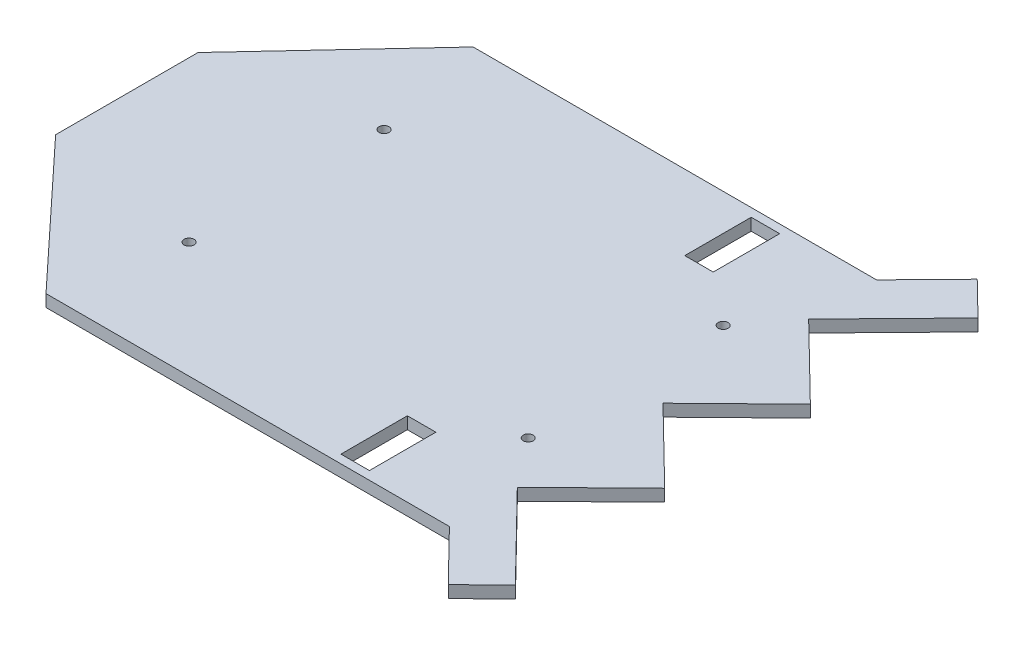
from build123d import *

# Parameters (mm, degrees)
BOSS_EXTRUDE2_DEPTH      = 5
BOSS_EXTRUDE2_DEPTH_BACK = 0.1
SKETCH6_R                = 2.1
CUT_EXTRUDE2_DEPTH       = 10
SKETCH2_W                = 12
SKETCH2_H                = 28
CUT_EXTRUDE3_DEPTH       = 10


with BuildPart() as part:
    # Sketch1 → Boss-Extrude2 (new, two sides: drawn at the far end of the back side and taken through both)
    with BuildSketch(Plane(origin=(0, 0, 0), x_dir=(1, 0, 0), z_dir=(0, 1, 0)).offset(-BOSS_EXTRUDE2_DEPTH_BACK)):
        Polygon((0, -30), (0, 30), (55.94480687, 90), (225.94480687, 90), (246.912660032, 111.45574827), (261.216492211, 97.477179495), (225.94480687, 61.384767177), (257.353801996, 30.69), (225.94480687, 0), (257.353801996, -30.69), (225.94480687, -61.384767177), (261.216492211, -97.477179495), (246.912660032, -111.45574827), (225.94480687, -90), (55.94480687, -90), align=None)
    extrude(amount=BOSS_EXTRUDE2_DEPTH + BOSS_EXTRUDE2_DEPTH_BACK)

    # Sketch6 → Cut-Extrude2 (cut)
    with BuildSketch(Plane(origin=(0, -0.1, 0), x_dir=(-1, 0, 0), z_dir=(0, -1, 0))):
        with Locations(Location((-67.309752753, 41.081967218, 0), (0, 0, 90))):
            Circle(SKETCH6_R)
        with Locations(Location((-210.227358504, 41.081967218, 0), (0, 0, 90))):
            Circle(SKETCH6_R)
        with Locations(Location((-210.227358504, -41.081967218, 0), (0, 0, 270))):
            Circle(SKETCH6_R)
        with Locations(Location((-67.309752753, -41.081967218, 0), (0, 0, 270))):
            Circle(SKETCH6_R)
    extrude(amount=-CUT_EXTRUDE2_DEPTH, mode=Mode.SUBTRACT)

    # Sketch2 → Cut-Extrude3 (cut)
    with BuildSketch(Plane.XZ.offset(0.1)):
        with Locations((182.674603171, -72.444256033)):
            Rectangle(SKETCH2_W, SKETCH2_H)
        with Locations((182.674603171, 72.444256033)):
            Rectangle(SKETCH2_W, SKETCH2_H)
    extrude(amount=-CUT_EXTRUDE3_DEPTH, mode=Mode.SUBTRACT)


solid = part.part
